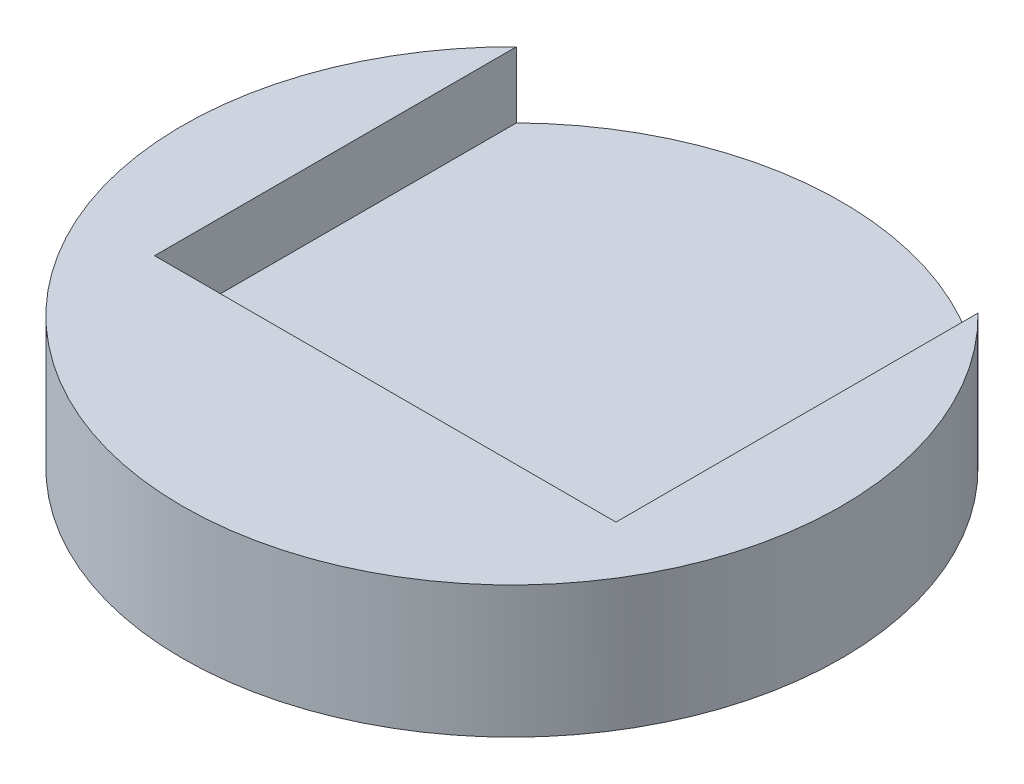
from build123d import *

# Parameters (mm, degrees)
SKETCH1_R           = 50
BOSS_EXTRUDE1_DEPTH = 20
SKETCH2_W           = 70
SKETCH2_H           = 55
CUT_EXTRUDE1_DEPTH  = 10
CUT_EXTRUDE3_START  = -10
CUT_EXTRUDE3_DEPTH  = 10


with BuildPart() as part:
    # Sketch1 → Boss-Extrude1 (new body)
    with BuildSketch(Plane(origin=(0, 0, 0), x_dir=(1, 0, 0), z_dir=(0, 1, 0))):
        with Locations(Location((0, 0, 0), (0, 0, 270))):
            Circle(SKETCH1_R)
    extrude(amount=BOSS_EXTRUDE1_DEPTH)

    # Sketch2 → Cut-Extrude1 (cut)
    with BuildSketch(Plane(origin=(0, 20, 0), x_dir=(1, 0, 0), z_dir=(0, 1, 0))):
        with Locations((-0.015145616, 8.297810168)):
            Rectangle(SKETCH2_W, SKETCH2_H)
    extrude(amount=-CUT_EXTRUDE1_DEPTH, mode=Mode.SUBTRACT)

    # Sketch3 → Cut-Extrude3 (cut)
    with BuildSketch(Plane(origin=(0, 20, 0), x_dir=(1, 0, 0), z_dir=(0, 1, 0)).offset(CUT_EXTRUDE3_START)):
        with BuildLine():
            Line((-35.015145616, 35.692290169), (34.984854384, 35.72198152))
            ThreePointArc((34.984854384, 35.72198152), (-0.021208106, 49.999995502), (-35.015145616, 35.692290169))
        make_face()
    extrude(amount=CUT_EXTRUDE3_DEPTH, mode=Mode.SUBTRACT)


solid = part.part
